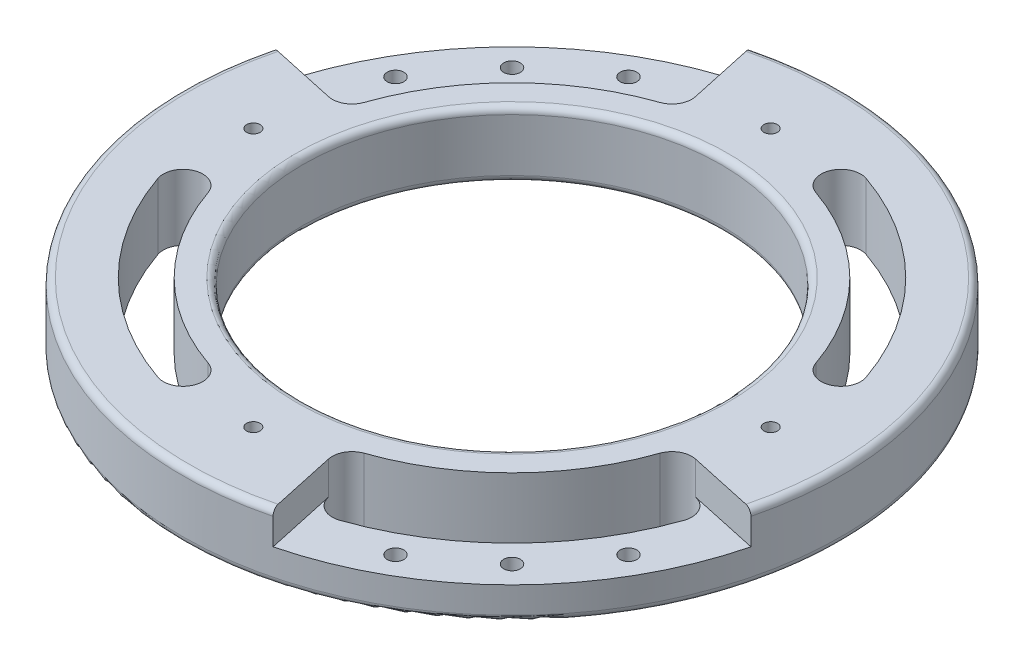
from build123d import *

# Parameters (mm, degrees)
SKETCH1_R           = 100
SKETCH1_R_2         = 2.05
SKETCH1_R_3         = 63.5
BOSS_EXTRUDE1_DEPTH = 20
FILLET1_R           = 2
CUT_EXTRUDE1_START  = -10
CUT_EXTRUDE1_DEPTH  = 10
SKETCH3_R           = 2.525
CUT_EXTRUDE2_DEPTH  = 10


with BuildPart() as part:
    # Sketch1 → Boss-Extrude1 (new body)
    with BuildSketch(Plane(origin=(0, 0, 0), x_dir=(1, 0, 0), z_dir=(0, 1, 0))):
        with Locations(Location((0, 0, 0), (0, 0, 270))):
            Circle(SKETCH1_R)
        with Locations(Location((-78.5, 0, 0), (0, 0, 270))):
            Circle(SKETCH1_R_2, mode=Mode.SUBTRACT)
        with Locations(Location((0, 78.5, 0), (0, 0, 270))):
            Circle(SKETCH1_R_2, mode=Mode.SUBTRACT)
        with Locations(Location((78.5, 0, 0), (0, 0, 270))):
            Circle(SKETCH1_R_2, mode=Mode.SUBTRACT)
        with Locations(Location((0, -78.5, 0), (0, 0, 270))):
            Circle(SKETCH1_R_2, mode=Mode.SUBTRACT)
        with Locations(Location((0, 0, 0), (0, 0, 270))):
            Circle(SKETCH1_R_3, mode=Mode.SUBTRACT)
        with BuildLine():
            ThreePointArc((-27.60081718, 79.865166944), (-59.75052301, 59.75052301), (-79.865166944, 27.60081718))
            ThreePointArc((-79.865166944, 27.60081718), (-76.154088854, 19.970096414), (-68.523368088, 23.681174504))
            ThreePointArc((-68.523368088, 23.681174504), (-51.265241636, 51.265241636), (-23.681174504, 68.523368088))
            ThreePointArc((-23.681174504, 68.523368088), (-19.970096414, 76.154088854), (-27.60081718, 79.865166944))
        make_face(mode=Mode.SUBTRACT)
        with BuildLine():
            ThreePointArc((79.865166944, 27.60081718), (59.75052301, 59.75052301), (27.60081718, 79.865166944))
            ThreePointArc((27.60081718, 79.865166944), (19.970096414, 76.154088854), (23.681174504, 68.523368088))
            ThreePointArc((23.681174504, 68.523368088), (51.265241636, 51.265241636), (68.523368088, 23.681174504))
            ThreePointArc((68.523368088, 23.681174504), (76.154088854, 19.970096414), (79.865166944, 27.60081718))
        make_face(mode=Mode.SUBTRACT)
        with BuildLine():
            ThreePointArc((27.60081718, -79.865166944), (59.75052301, -59.75052301), (79.865166944, -27.60081718))
            ThreePointArc((79.865166944, -27.60081718), (76.154088854, -19.970096414), (68.523368088, -23.681174504))
            ThreePointArc((68.523368088, -23.681174504), (51.265241636, -51.265241636), (23.681174504, -68.523368088))
            ThreePointArc((23.681174504, -68.523368088), (19.970096414, -76.154088854), (27.60081718, -79.865166944))
        make_face(mode=Mode.SUBTRACT)
        with BuildLine():
            ThreePointArc((-79.865166944, -27.60081718), (-59.75052301, -59.75052301), (-27.60081718, -79.865166944))
            ThreePointArc((-27.60081718, -79.865166944), (-19.970096414, -76.154088854), (-23.681174504, -68.523368088))
            ThreePointArc((-23.681174504, -68.523368088), (-51.265241636, -51.265241636), (-68.523368088, -23.681174504))
            ThreePointArc((-68.523368088, -23.681174504), (-76.154088854, -19.970096414), (-79.865166944, -27.60081718))
        make_face(mode=Mode.SUBTRACT)
    extrude(amount=BOSS_EXTRUDE1_DEPTH)

    # Fillet1
    fillet1_edges = [part.edges().sort_by_distance(p)[0] for p in [
        (0, 0, -100),
        (0, 20, -100),
        (0, 0, -63.5),
        (0, 20, -63.5),
    ]]
    fillet(fillet1_edges, radius=FILLET1_R)

    # Sketch2 → Cut-Extrude1 (cut)
    with BuildSketch(Plane(origin=(0, 20, 0), x_dir=(1, 0, 0), z_dir=(0, 1, 0)).offset(CUT_EXTRUDE1_START)):
        with BuildLine():
            Line((-19.777543396, 75.467030422), (-24.444340717, 96.966356057))
            ThreePointArc((-24.444340717, 96.966356057), (-70.710678119, 70.710678119), (-96.966356057, 24.444340717))
            Line((-96.966356057, 24.444340717), (-75.467030422, 19.777543396))
            ThreePointArc((-75.467030422, 19.777543396), (-71.253946926, 20.410841463), (-68.523368088, 23.681174504))
            ThreePointArc((-68.523368088, 23.681174504), (-51.265241636, 51.265241636), (-23.681174504, 68.523368088))
            ThreePointArc((-23.681174504, 68.523368088), (-20.410841463, 71.253946926), (-19.777543396, 75.467030422))
        make_face()
        with BuildLine():
            Line((19.777543396, -75.467030422), (24.444340717, -96.966356057))
            ThreePointArc((24.444340717, -96.966356057), (70.710678119, -70.710678119), (96.966356057, -24.444340717))
            Line((96.966356057, -24.444340717), (75.467030422, -19.777543396))
            ThreePointArc((75.467030422, -19.777543396), (71.253946926, -20.410841463), (68.523368088, -23.681174504))
            ThreePointArc((68.523368088, -23.681174504), (51.265241636, -51.265241636), (23.681174504, -68.523368088))
            ThreePointArc((23.681174504, -68.523368088), (20.410841463, -71.253946926), (19.777543396, -75.467030422))
        make_face()
    extrude(amount=CUT_EXTRUDE1_DEPTH, mode=Mode.SUBTRACT)

    # Sketch3 → Cut-Extrude2 (cut)
    with BuildSketch(Plane(origin=(0, 10, 0), x_dir=(1, 0, 0), z_dir=(0, 1, 0))):
        with Locations(Location((-45.111909622, 80.467248681, 0), (0, 0, 270))):
            Circle(SKETCH3_R)
        with Locations(Location((-65.230600564, 65.230600564, 0), (0, 0, 270))):
            Circle(SKETCH3_R)
        with Locations(Location((-80.467248681, 45.111909622, 0), (0, 0, 270))):
            Circle(SKETCH3_R)
        with Locations(Location((45.111909622, -80.467248681, 0), (0, 0, 90))):
            Circle(SKETCH3_R)
        with Locations(Location((65.230600564, -65.230600564, 0), (0, 0, 90))):
            Circle(SKETCH3_R)
        with Locations(Location((80.467248681, -45.111909622, 0), (0, 0, 90))):
            Circle(SKETCH3_R)
    extrude(amount=-CUT_EXTRUDE2_DEPTH, mode=Mode.SUBTRACT)


solid = part.part
